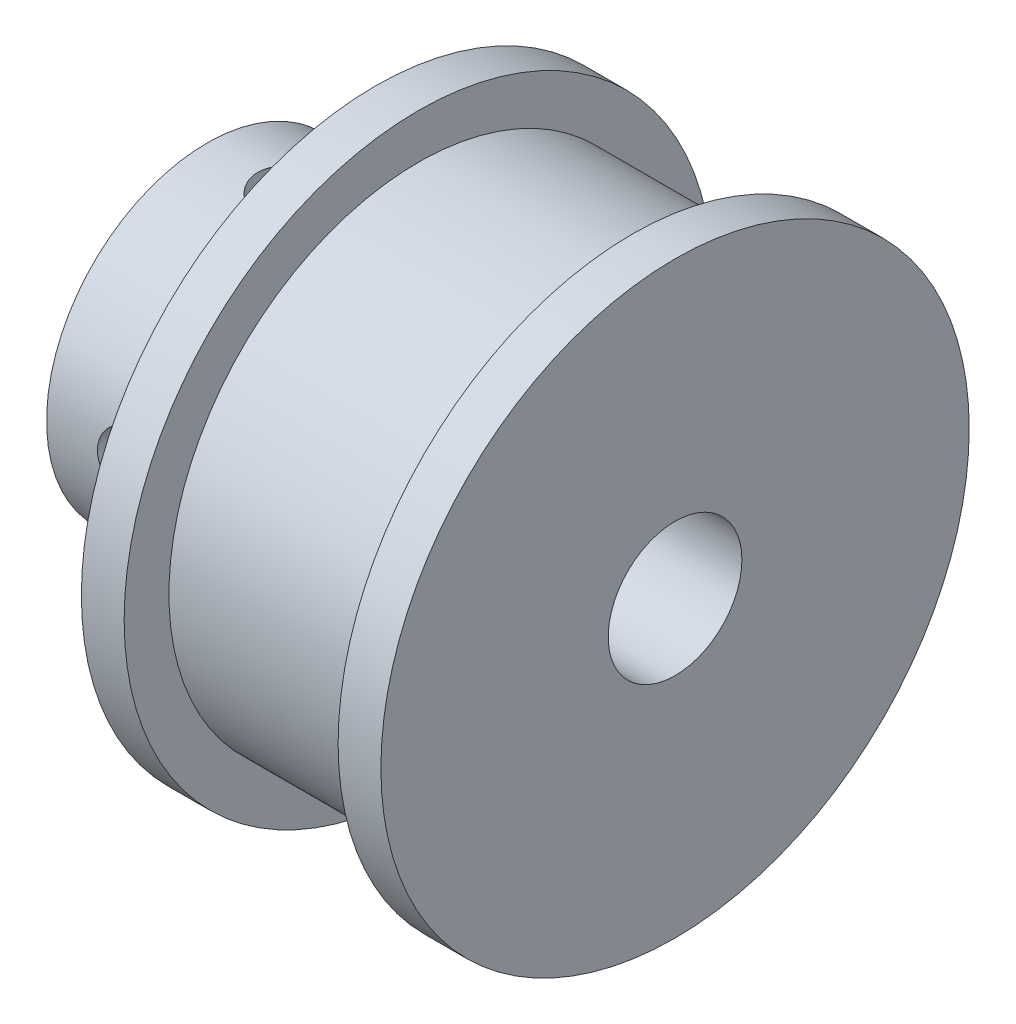
from build123d import *

# Parameters (mm, degrees)
SKETCH2_W = 1.25
SKETCH2_H = 11
SKETCH4_W = 1.25
SKETCH4_H = 11


with BuildPart() as part:
    # Sketch1 → Revolve1 (revolve)
    with BuildSketch(Plane.XY, mode=Mode.PRIVATE) as revolve1_sk:
        Polygon((0, 2.5), (0, 6), (6.3, 6), (6.3, 11), (7.9, 11), (7.9, 9.325), (15.9, 9.325), (15.9, 11), (17.5, 11), (17.5, 2.5), align=None)
    revolve(revolve1_sk.sketch.rotate(Axis((0, 0, 0), (-1, 0, 0)), 90), axis=Axis((0, 0, 0), (-1, 0, 0)))

    # Sketch2 → M3x0.5 Tapped Hole1 (revolve, cut)
    with BuildSketch(Plane(origin=(3.15, 0, 0), x_dir=(0, 0, -1), z_dir=(1, 0, 0))):
        with Locations((0.625, 5.5)):
            Rectangle(SKETCH2_W, SKETCH2_H)
    revolve(axis=Axis((3.15, -6.35, 0), (0, 1, 0)), mode=Mode.SUBTRACT)

    # Sketch4 → M3x0.5 Tapped Hole2 (revolve, cut)
    with BuildSketch(Plane.YZ.offset(3.15)):
        with Locations((0.625, 5.5)):
            Rectangle(SKETCH4_W, SKETCH4_H)
    revolve(axis=Axis((3.15, 0, -6.35), (0, 0, 1)), mode=Mode.SUBTRACT)


solid = part.part
